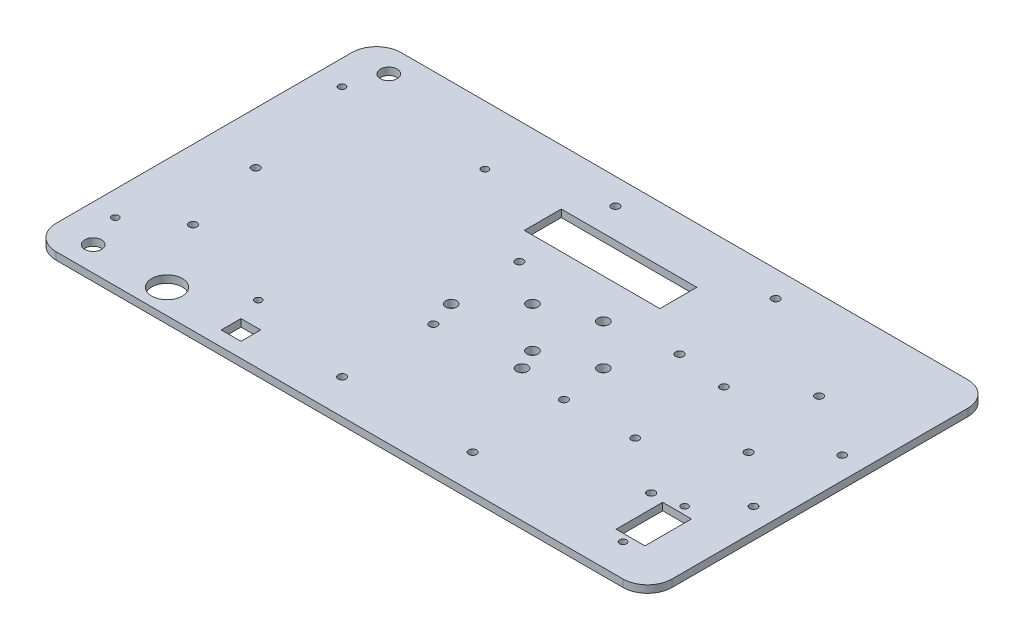
from build123d import *

# Parameters (mm, degrees)
SKETCH1_W               = 250
SKETCH1_H               = 140
BOSS_EXTRUDE1_DEPTH     = 3
FILLET2_R               = 10
CUT_EXTRUDE5_DEPTH      = 7
CUT_EXTRUDE5_DEPTH_BACK = 7
SKETCH2_R               = 1.55
SKETCH2_R_2             = 1.6
SKETCH2_R_3             = 2.25
SKETCH2_R_4             = 1.4
CUT_EXTRUDE6_DEPTH      = 7
CUT_EXTRUDE6_DEPTH_BACK = 7
SKETCH3_R               = 1.6
CUT_EXTRUDE7_DEPTH      = 7
CUT_EXTRUDE7_DEPTH_BACK = 7
SKETCH4_R               = 1.6
CUT_EXTRUDE8_DEPTH      = 7
CUT_EXTRUDE8_DEPTH_BACK = 7
SKETCH5_R               = 1.4
SKETCH5_W               = 11.7
SKETCH5_H               = 18.9
SKETCH5_R_2             = 3.4
SKETCH5_R_3             = 6.2
CUT_EXTRUDE9_DEPTH      = 144.296894593
CUT_EXTRUDE9_DEPTH_BACK = 144.296894593
SKETCH6_R               = 1.6


with BuildPart() as part:
    # Sketch1 → Boss-Extrude1 (new body)
    with BuildSketch(Plane(origin=(0, 0, 0), x_dir=(1, 0, 0), z_dir=(0, 1, 0))):
        Rectangle(SKETCH1_W, SKETCH1_H)
    extrude(amount=BOSS_EXTRUDE1_DEPTH)

    # Fillet2
    fillet2_edges = [part.edges().sort_by_distance(p)[0] for p in [
        (-125, 1.5, 70),
        (125, 1.5, 70),
        (-125, 1.5, -70),
        (125, 1.5, -70),
    ]]
    fillet(fillet2_edges, radius=FILLET2_R)

    # Sketch2 → Cut-Extrude5 (cut, two sides: drawn at the far end of the back side and taken through both)
    with BuildSketch(Plane(origin=(0, 0, 0), x_dir=(1, 0, 0), z_dir=(0, 1, 0)).offset(-CUT_EXTRUDE5_DEPTH_BACK)):
        with Locations((116, 18)):
            Circle(SKETCH2_R)
        with Locations((68, 18)):
            Circle(SKETCH2_R)
        with Locations((68, -18)):
            Circle(SKETCH2_R)
        with Locations((116, -18)):
            Circle(SKETCH2_R)
        with Locations((-13, -18.939424071)):
            Circle(SKETCH2_R_2)
        with Locations((-13, -55.939424071)):
            Circle(SKETCH2_R_2)
        with Locations((40, -18.939424071)):
            Circle(SKETCH2_R_2)
        with Locations((40, -55.939424071)):
            Circle(SKETCH2_R_2)
        with Locations((37, 0.060575929)):
            Circle(SKETCH2_R_3)
        with Locations((20.5, 16.560575929)):
            Circle(SKETCH2_R_3)
        with Locations((20.5, -16.439424071)):
            Circle(SKETCH2_R_3)
        with Locations((96, 0)):
            Circle(SKETCH2_R_2)
        with Locations((-104, 0)):
            Circle(SKETCH2_R_2)
        with Locations((-115, 46)):
            Circle(SKETCH2_R_4)
        with Locations((-57, 46)):
            Circle(SKETCH2_R_4)
        with Locations((-57, -46)):
            Circle(SKETCH2_R_4)
        with Locations((-115, -46)):
            Circle(SKETCH2_R_4)
        with Locations((-16.5, -8.189424071)):
            Circle(SKETCH2_R_3)
        with Locations((16.5, -8.189424071)):
            Circle(SKETCH2_R_3)
        with Locations((0, 8.310575929)):
            Circle(SKETCH2_R_3)
    extrude(amount=CUT_EXTRUDE5_DEPTH + CUT_EXTRUDE5_DEPTH_BACK, mode=Mode.SUBTRACT)

    # Sketch3 → Cut-Extrude6 (cut, two sides: drawn at the far end of the back side and taken through both)
    with BuildSketch(Plane(origin=(0, 0, 0), x_dir=(1, 0, 0), z_dir=(0, 1, 0)).offset(-CUT_EXTRUDE6_DEPTH_BACK)):
        with Locations((-96.745, -32.704968659)):
            Circle(SKETCH3_R)
    extrude(amount=CUT_EXTRUDE6_DEPTH + CUT_EXTRUDE6_DEPTH_BACK, mode=Mode.SUBTRACT)

    # Sketch4 → Cut-Extrude7 (cut, two sides: drawn at the far end of the back side and taken through both)
    with BuildSketch(Plane(origin=(0, 3, 0), x_dir=(1, 0, 0), z_dir=(0, 1, 0)).offset(-CUT_EXTRUDE7_DEPTH_BACK)):
        with Locations((90.54, -34.065208057)):
            Circle(SKETCH4_R)
        with Locations((90.54, 34.065208057)):
            Circle(SKETCH4_R)
    extrude(amount=CUT_EXTRUDE7_DEPTH + CUT_EXTRUDE7_DEPTH_BACK, mode=Mode.SUBTRACT)

    # Sketch5 → Cut-Extrude8 (cut, two sides: drawn at the far end of the back side and taken through both)
    with BuildSketch(Plane(origin=(0, 3, 0), x_dir=(1, 0, 0), z_dir=(0, 1, 0)).offset(-CUT_EXTRUDE8_DEPTH_BACK)):
        with Locations((102, -31.945997938)):
            Circle(SKETCH5_R)
        with Locations((102, -44.445997938)):
            Rectangle(SKETCH5_W, SKETCH5_H)
        with Locations((102, -56.945997938)):
            Circle(SKETCH5_R)
        with Locations((-110, -60)):
            Circle(SKETCH5_R_2)
        Polygon((-54, -56), (-54, -60), (-54, -64), (-46, -64), (-46, -56), align=None)
        with Locations((-80, -60)):
            Circle(SKETCH5_R_3)
        with Locations((-110, 60)):
            Circle(SKETCH5_R_2)
        Polygon((0, 47.5), (-27.5, 47.5), (-27.5, 32.5), (27.5, 32.5), (27.5, 47.5), align=None)
    extrude(amount=CUT_EXTRUDE8_DEPTH + CUT_EXTRUDE8_DEPTH_BACK, mode=Mode.SUBTRACT)

    # Sketch6 → Cut-Extrude9 (cut, two sides: drawn at the far end of the back side and taken through both)
    with BuildSketch(Plane(origin=(0, 3, 0), x_dir=(1, 0, 0), z_dir=(0, 1, 0)).offset(-CUT_EXTRUDE9_DEPTH_BACK)):
        with Locations((-17.5, 59.5)):
            Circle(SKETCH6_R)
        with Locations((47.5, 59.5)):
            Circle(SKETCH6_R)
        with Locations((-17.5, 20.5)):
            Circle(SKETCH6_R)
        with Locations((47.5, 20.5)):
            Circle(SKETCH6_R)
    extrude(amount=CUT_EXTRUDE9_DEPTH + CUT_EXTRUDE9_DEPTH_BACK, mode=Mode.SUBTRACT)


solid = part.part
